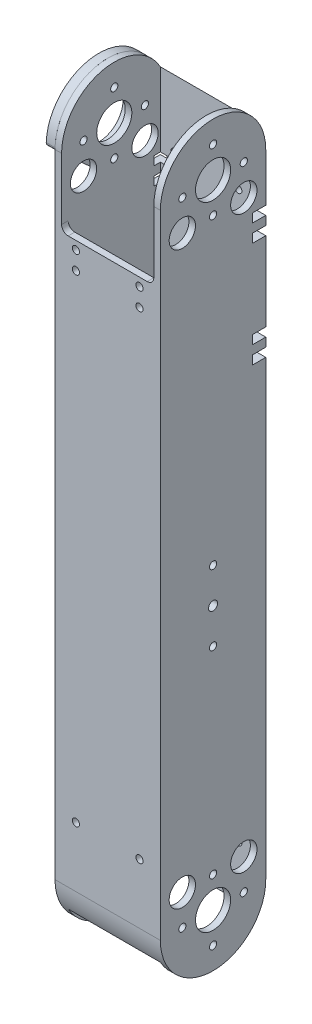
from build123d import *

# Parameters (mm, degrees)
BOSS_EXTRUDE1_START     = 33.3375
SKETCH1_R               = 12.7
BOSS_EXTRUDE1_DEPTH     = 4.7625
BOSS_EXTRUDE2_START     = -38.1
SKETCH1_6_R             = 12.7
BOSS_EXTRUDE2_DEPTH     = 4.7625
BOSS_EXTRUDE3_DEPTH     = 33.3375
BOSS_EXTRUDE4_START     = -38.1
BOSS_EXTRUDE4_DEPTH     = 38.1
SKETCH2_W               = 66.675
SKETCH2_H               = 67.807583187
CUT_EXTRUDE1_DEPTH      = 4.7625
SKETCH3_R               = 2.603499999
CUT_EXTRUDE2_DEPTH      = 4.7625
SKETCH4_R               = 2.6035
CUT_EXTRUDE3_DEPTH      = 4.7625
SKETCH5_R               = 2.6035
SKETCH5_R_2             = 3.2639
CUT_EXTRUDE4_DEPTH      = 688.71544222
CUT_EXTRUDE5_DEPTH      = 685.541963263
CUT_EXTRUDE5_DEPTH_BACK = 685.541963263
SKETCH6_R               = 2.6035
SKETCH7_R               = 9.525
CUT_EXTRUDE6_DEPTH      = 688.71544222
FILLET1_R               = 4.7625
SKETCH8_W               = 9.525
SKETCH8_H               = 6.35
CUT_EXTRUDE7_DEPTH      = 9.525
SKETCH9_R               = 2.6035
SKETCH9_R_2             = 17.4625
BOSS_EXTRUDE5_DEPTH     = 6.35
FILLET2_R               = 2.54


with BuildPart() as part:
    # Sketch1 → Boss-Extrude1 (new body)
    with BuildSketch(Plane(origin=(0, 0, 0), x_dir=(0, 0, -1), z_dir=(1, 0, 0)).offset(BOSS_EXTRUDE1_START)):
        with BuildLine():
            Line((41.306573009, 186.931527045), (41.306573009, 644.131527045))
            ThreePointArc((41.306573009, 644.131527045), (3.206573009, 682.231527045), (-34.893426991, 644.131527045))
            Line((-34.893426991, 644.131527045), (-34.893426991, 186.931527045))
            ThreePointArc((-34.893426991, 186.931527045), (3.206573009, 148.831527045), (41.306573009, 186.931527045))
        make_face()
        with Locations((3.206573009, 186.931527045)):
            Circle(SKETCH1_R, mode=Mode.SUBTRACT)
        with Locations((3.206573009, 644.131527045)):
            Circle(SKETCH1_R, mode=Mode.SUBTRACT)
    extrude(amount=BOSS_EXTRUDE1_DEPTH)

    # Sketch1<7> → Boss-Extrude3 (add)
    with BuildSketch(Plane(origin=(0, 0, 0), x_dir=(0, 0, -1), z_dir=(1, 0, 0))):
        with BuildLine():
            ThreePointArc((-34.893426991, 186.931527045), (-33.683593364, 177.406527045), (-30.130926991, 168.486443859))
            Line((-30.130926991, 168.486443859), (-30.130926991, 662.576610232))
            ThreePointArc((-30.130926991, 662.576610232), (-33.683593364, 653.656527045), (-34.893426991, 644.131527045))
            Line((-34.893426991, 644.131527045), (-34.893426991, 186.931527045))
        make_face()
        with BuildLine():
            ThreePointArc((36.544073009, 168.486443859), (40.096739381, 177.406527045), (41.306573009, 186.931527045))
            Line((41.306573009, 186.931527045), (41.306573009, 644.131527045))
            ThreePointArc((41.306573009, 644.131527045), (40.096739381, 653.656527045), (36.544073009, 662.576610232))
            Line((36.544073009, 662.576610232), (36.544073009, 168.486443859))
        make_face()
    extrude(amount=BOSS_EXTRUDE3_DEPTH)



with BuildPart() as body_2:
    # Sketch1<6> → Boss-Extrude2 (new body)
    with BuildSketch(Plane(origin=(0, 0, 0), x_dir=(0, 0, -1), z_dir=(1, 0, 0)).offset(BOSS_EXTRUDE2_START)):
        with BuildLine():
            Line((41.306573009, 186.931527045), (41.306573009, 644.131527045))
            ThreePointArc((41.306573009, 644.131527045), (3.206573009, 682.231527045), (-34.893426991, 644.131527045))
            Line((-34.893426991, 644.131527045), (-34.893426991, 186.931527045))
            ThreePointArc((-34.893426991, 186.931527045), (3.206573009, 148.831527045), (41.306573009, 186.931527045))
        make_face()
        with Locations(Location((3.206573009, 186.931527045, 0), (0, 0, 180))):
            Circle(SKETCH1_6_R, mode=Mode.SUBTRACT)
        with Locations(Location((3.206573009, 644.131527045, 0), (0, 0, 180))):
            Circle(SKETCH1_6_R, mode=Mode.SUBTRACT)
    extrude(amount=BOSS_EXTRUDE2_DEPTH)


with BuildPart() as part_1:
    add(part.part)

    add(body_2.part)  # Boss-Extrude4 merges body 2
    # Sketch1<8> → Boss-Extrude4 (add)
    with BuildSketch(Plane(origin=(0, 0, 0), x_dir=(0, 0, -1), z_dir=(1, 0, 0)).offset(BOSS_EXTRUDE4_START)):
        with BuildLine():
            ThreePointArc((-34.893426991, 186.931527045), (-33.683593364, 177.406527045), (-30.130926991, 168.486443859))
            Line((-30.130926991, 168.486443859), (-30.130926991, 662.576610232))
            ThreePointArc((-30.130926991, 662.576610232), (-33.683593364, 653.656527045), (-34.893426991, 644.131527045))
            Line((-34.893426991, 644.131527045), (-34.893426991, 186.931527045))
        make_face()
        with BuildLine():
            ThreePointArc((36.544073009, 168.486443859), (40.096739381, 177.406527045), (41.306573009, 186.931527045))
            Line((41.306573009, 186.931527045), (41.306573009, 644.131527045))
            ThreePointArc((41.306573009, 644.131527045), (40.096739381, 653.656527045), (36.544073009, 662.576610232))
            Line((36.544073009, 662.576610232), (36.544073009, 168.486443859))
        make_face()
    extrude(amount=BOSS_EXTRUDE4_DEPTH)

    # Sketch2 → Cut-Extrude1 (cut)
    with BuildSketch(Plane.XY.offset(34.893426991)):
        with Locations((0, 628.672818639)):
            Rectangle(SKETCH2_W, SKETCH2_H)
    extrude(amount=-CUT_EXTRUDE1_DEPTH, mode=Mode.SUBTRACT)

    # Sketch3 → Cut-Extrude2 (cut)
    with BuildSketch(Plane.XY.offset(34.893426991)):
        with Locations((23, 575.769027045)):
            Circle(SKETCH3_R)
        with Locations((23, 588.769027045)):
            Circle(SKETCH3_R)
        with Locations((-23, 575.769027045)):
            Circle(SKETCH3_R)
        with Locations((-23, 588.769027045)):
            Circle(SKETCH3_R)
        with Locations((-23, 230.269027045)):
            Circle(SKETCH3_R)
        with Locations((23, 230.269027045)):
            Circle(SKETCH3_R)
    extrude(amount=-CUT_EXTRUDE2_DEPTH, mode=Mode.SUBTRACT)

    # Sketch4 → Cut-Extrude3 (cut)
    with BuildSketch(Plane(origin=(0, 0, -41.306573009), x_dir=(-1, 0, 0), z_dir=(0, 0, -1))):
        with Locations(Location((-23, 205.631527043, 0), (0, 0, 90))):
            Circle(SKETCH4_R)
        with Locations(Location((-23, 218.631527043, 0), (0, 0, 90))):
            Circle(SKETCH4_R)
        with Locations(Location((23, 218.631527043, 0), (0, 0, 90))):
            Circle(SKETCH4_R)
        with Locations(Location((23, 205.631527043, 0), (0, 0, 90))):
            Circle(SKETCH4_R)
        with Locations(Location((23, 614.131527043, 0), (0, 0, 90))):
            Circle(SKETCH4_R)
        with Locations(Location((-23, 614.131527043, 0), (0, 0, 90))):
            Circle(SKETCH4_R)
    extrude(amount=-CUT_EXTRUDE3_DEPTH, mode=Mode.SUBTRACT)

    # Sketch5 → Cut-Extrude4 (cut, through all)
    with BuildSketch(Plane.ZY.offset(38.1)):
        with Locations(Location((-3.206573009, 352.031527045, 0), (0, 0, 270))):
            Circle(SKETCH5_R)
        with Locations((-3.206573009, 402.831527045)):
            Circle(SKETCH5_R)
        with Locations(Location((-3.206573009, 377.431527045, 0), (0, 0, 270))):
            Circle(SKETCH5_R_2)
    extrude(amount=-CUT_EXTRUDE4_DEPTH, mode=Mode.SUBTRACT)

    # Sketch6 → Cut-Extrude5 (cut, two sides: drawn at the far end of the back side and taken through both)
    with BuildSketch(Plane(origin=(0, 0, 0), x_dir=(0, 0, -1), z_dir=(1, 0, 0)).offset(-CUT_EXTRUDE5_DEPTH_BACK)):
        with Locations((25.431573009, 186.931527045)):
            Circle(SKETCH6_R)
        with Locations((3.206573009, 209.156527045)):
            Circle(SKETCH6_R)
        with Locations((-19.018426991, 186.931527045)):
            Circle(SKETCH6_R)
        with Locations((3.206573009, 164.706527045)):
            Circle(SKETCH6_R)
        with Locations((-19.018426991, 644.131527045)):
            Circle(SKETCH6_R)
        with Locations((3.206573009, 666.356527045)):
            Circle(SKETCH6_R)
        with Locations((25.431573009, 644.131527045)):
            Circle(SKETCH6_R)
        with Locations((3.206573009, 621.906527045)):
            Circle(SKETCH6_R)
    extrude(amount=CUT_EXTRUDE5_DEPTH + CUT_EXTRUDE5_DEPTH_BACK, mode=Mode.SUBTRACT)

    # Sketch7 → Cut-Extrude6 (cut, through all)
    with BuildSketch(Plane(origin=(38.1, 0, 0), x_dir=(0, 0, -1), z_dir=(1, 0, 0))):
        with Locations((25.431573009, 209.156527045)):
            Circle(SKETCH7_R)
        with Locations((25.431573009, 621.906527045)):
            Circle(SKETCH7_R)
        with Locations((-19.018426991, 209.156527045)):
            Circle(SKETCH7_R)
        with Locations((-19.018426991, 621.906527045)):
            Circle(SKETCH7_R)
    extrude(amount=-CUT_EXTRUDE6_DEPTH, mode=Mode.SUBTRACT)

    # Fillet1
    fillet1_edges = [part_1.edges().sort_by_distance(p)[0] for p in [
        (-33.3375, 594.769027045, 32.512176991),
        (33.3375, 594.769027045, 32.512176991),
    ]]
    fillet(fillet1_edges, radius=FILLET1_R)

    # Sketch8 → Cut-Extrude7 (cut)
    with BuildSketch(Plane.ZY.offset(38.1)):
        with Locations((-36.544073009, 606.031527045)):
            Rectangle(SKETCH8_W, SKETCH8_H)
        with Locations((-36.544073009, 593.331527045)):
            Rectangle(SKETCH8_W, SKETCH8_H)
        with Locations((-36.544073009, 529.831527045)):
            Rectangle(SKETCH8_W, SKETCH8_H)
        with Locations((-36.544073009, 517.131527045)):
            Rectangle(SKETCH8_W, SKETCH8_H)
    cut_extrude7 = extrude(amount=-CUT_EXTRUDE7_DEPTH, mode=Mode.SUBTRACT)

    # Mirror1: Cut-Extrude7 across plane
    add(cut_extrude7.mirror(Plane(origin=(0, 0, 0), x_dir=(0, 0, 1), z_dir=(1, 0, 0))), mode=Mode.SUBTRACT)


with BuildPart() as body_2_2:
    # Sketch9 → Boss-Extrude5 (new body)
    with BuildSketch(Plane.ZY.offset(38.1)):
        with BuildLine():
            ThreePointArc((34.893426991, 644.131527045), (-3.206573009, 682.231527045), (-41.306573009, 644.131527045))
            Line((-41.306573009, 644.131527045), (-3.206573009, 609.206527045))
            Line((-3.206573009, 609.206527045), (34.893426991, 644.131527045))
        make_face()
        with Locations((-3.206573009, 621.906527045)):
            Circle(SKETCH9_R, mode=Mode.SUBTRACT)
        with Locations((-25.431573009, 644.131527045)):
            Circle(SKETCH9_R, mode=Mode.SUBTRACT)
        with Locations((-3.206573009, 644.131527045)):
            Circle(SKETCH9_R_2, mode=Mode.SUBTRACT)
        with Locations((19.018426991, 644.131527045)):
            Circle(SKETCH9_R, mode=Mode.SUBTRACT)
        with Locations((-3.206573009, 666.356527045)):
            Circle(SKETCH9_R, mode=Mode.SUBTRACT)
        with BuildLine():
            ThreePointArc((-6.381573009, 672.52959036), (-24.505120494, 663.181527045), (-31.781573009, 644.131527045))
            Line((-31.781573009, 644.131527045), (-38.131573009, 644.131527045))
            ThreePointArc((-38.131573009, 644.131527045), (-29.000394943, 667.677957242), (-6.381573009, 678.911909447))
            Line((-6.381573009, 678.911909447), (-6.381573009, 672.52959036))
        make_face(mode=Mode.SUBTRACT)
        with BuildLine():
            ThreePointArc((25.368426991, 644.131527045), (18.091974477, 663.181527045), (-0.031573009, 672.52959036))
            Line((-0.031573009, 672.52959036), (-0.031573009, 678.911909447))
            ThreePointArc((-0.031573009, 678.911909447), (22.587248926, 667.677957242), (31.718426991, 644.131527045))
            Line((31.718426991, 644.131527045), (25.368426991, 644.131527045))
        make_face(mode=Mode.SUBTRACT)
    extrude(amount=BOSS_EXTRUDE5_DEPTH)

    # Fillet2
    fillet2_edges = [body_2_2.edges().sort_by_distance(p)[0] for p in [
        (-41.275, 644.131527045, 31.718426991),
        (-41.275, 678.911909447, -0.031573009),
        (-41.275, 672.52959036, -0.031573009),
        (-41.275, 644.131527045, 25.368426991),
        (-41.275, 609.206527045, -3.206573009),
        (-41.275, 644.131527045, -41.306573009),
        (-41.275, 644.131527045, 34.893426991),
        (-41.275, 678.911909447, -6.381573009),
        (-41.275, 644.131527045, -38.131573009),
        (-41.275, 644.131527045, -31.781573009),
        (-41.275, 672.52959036, -6.381573009),
    ]]
    fillet(fillet2_edges, radius=FILLET2_R)


solid = Compound([part_1.part, body_2_2.part])
